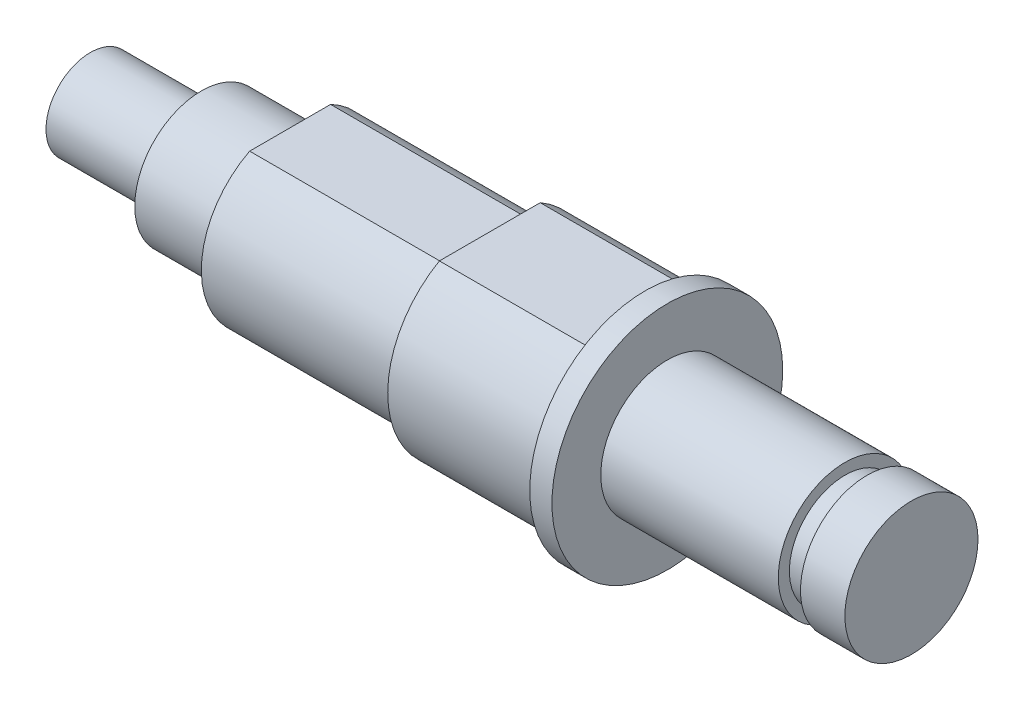
from build123d import *

# Parameters (mm, degrees)
SKETCH_1_R          = 1.5
EXTRUDE_1_DEPTH     = 18.5
SKETCH_2_R          = 1.5
EXTRUDE_2_DEPTH     = 3.5
SKETCH_3_R          = 2.6
SKETCH_3_R_2        = 1.5
EXTRUDE_3_DEPTH     = 0.5
EXTRUDE_START       = 4.5
SKETCH_7_R          = 1.5
EXTRUDE_4_DEPTH     = 4.5
CUT_EXTRUDE_START   = -1.5
SKETCH_4_R          = 1.5
SKETCH_4_R_2        = 1.25
CUT_EXTRUDE_1_DEPTH = 0.5
SKETCH_5_R          = 2
SKETCH_5_R_2        = 1
CUT_EXTRUDE_2_DEPTH = 2.5


with BuildPart() as part:
    # 草图1 → 凸台-拉伸1 (new body)
    with BuildSketch(Plane(origin=(0, 0, 0), x_dir=(0, 0, -1), z_dir=(1, 0, 0))):
        Circle(SKETCH_1_R)
    extrude(amount=EXTRUDE_1_DEPTH)

    # 草图2 → 凸台-拉伸2 (add)
    with BuildSketch(Plane.ZY.offset(-9)):
        with BuildLine():
            Line((-1.135781669, 2), (1.135781669, 2))
            ThreePointArc((1.135781669, 2), (0, -2.3), (-1.135781669, 2))
        make_face()
        Circle(SKETCH_2_R, mode=Mode.SUBTRACT)
    extrude(amount=-EXTRUDE_2_DEPTH)

    # 草图3 → 凸台-拉伸3 (add)
    with BuildSketch(Plane(origin=(12.5, 0, 0), x_dir=(0, 0, -1), z_dir=(1, 0, 0))):
        Circle(SKETCH_3_R)
        with Locations(Location((0, 0, 0), (0, 0, 180))):
            Circle(SKETCH_3_R_2, mode=Mode.SUBTRACT)
    extrude(amount=EXTRUDE_3_DEPTH)

    # 草图7 → 凸台-拉伸4 (add)
    with BuildSketch(Plane.ZY.offset(-9).offset(EXTRUDE_START)):
        with BuildLine():
            Line((-0.911921049, 1.78), (0.911921049, 1.78))
            ThreePointArc((0.911921049, 1.78), (0, -2), (-0.911921049, 1.78))
        make_face()
        with Locations(Location((0, 0, 0), (0, 0, 180))):
            Circle(SKETCH_7_R, mode=Mode.SUBTRACT)
    extrude(amount=-EXTRUDE_4_DEPTH)

    # 草图4 → 切除-拉伸1 (cut)
    with BuildSketch(Plane(origin=(18.5, 0, 0), x_dir=(0, 0, -1), z_dir=(1, 0, 0)).offset(CUT_EXTRUDE_START)):
        Circle(SKETCH_4_R)
        Circle(SKETCH_4_R_2, mode=Mode.SUBTRACT)
    extrude(amount=CUT_EXTRUDE_1_DEPTH, mode=Mode.SUBTRACT)

    # 草图5 → 切除-拉伸2 (cut)
    with BuildSketch(Plane.ZY):
        Circle(SKETCH_5_R)
        Circle(SKETCH_5_R_2, mode=Mode.SUBTRACT)
    extrude(amount=-CUT_EXTRUDE_2_DEPTH, mode=Mode.SUBTRACT)


solid = part.part
